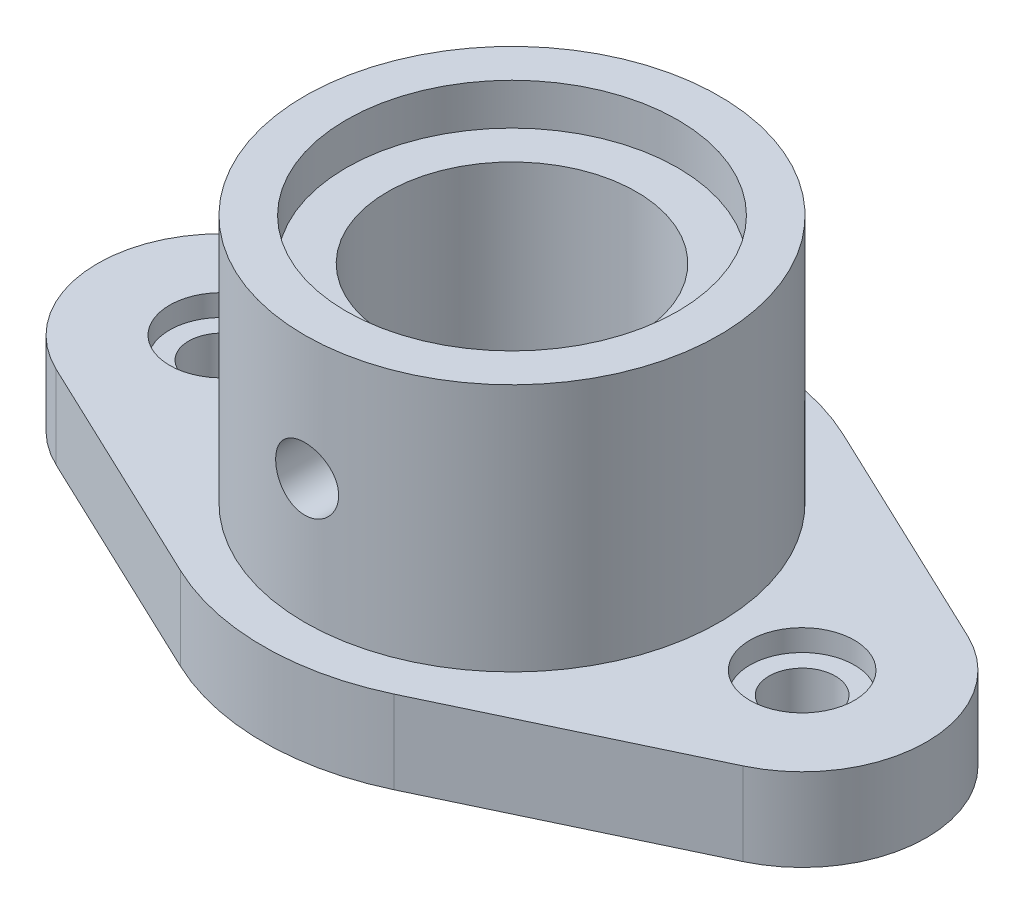
from build123d import *

# Parameters (mm, degrees)
BOSS_EXTRUDE1_DEPTH                                  = 12.7
SKETCH2_R                                            = 31.75
BOSS_EXTRUDE2_DEPTH                                  = 38.1
CBORE_FOR_3_8_BINDING_HEAD_MACHINE_SCREW_D           = 38.1
CBORE_FOR_3_8_BINDING_HEAD_MACHINE_SCREW_CBORE_D     = 50.8
CBORE_FOR_3_8_BINDING_HEAD_MACHINE_SCREW_CBORE_DEPTH = 6.35
CBORE_FOR_3_8_BINDING_HEAD_MACHINE_S_2_D             = 10.16
CBORE_FOR_3_8_BINDING_HEAD_MACHINE_S_2_CBORE_D       = 16.002
CBORE_FOR_3_8_BINDING_HEAD_MACHINE_S_2_CBORE_DEPTH   = 3.302
SKETCH9_W                                            = 4.826
SKETCH9_H                                            = 38.1


with BuildPart() as part:
    # Sketch1 → Boss-Extrude1 (new body)
    with BuildSketch(Plane(origin=(0, 0, 0), x_dir=(1, 0, 0), z_dir=(0, 1, 0))):
        with BuildLine():
            Line((-52.614285714, 17.21182555), (-16.328571429, 34.423651101))
            ThreePointArc((-16.328571429, 34.423651101), (0, 38.1), (16.328571429, 34.423651101))
            Line((16.328571429, 34.423651101), (52.614285714, 17.21182555))
            ThreePointArc((52.614285714, 17.21182555), (63.5, 0), (52.614285714, -17.21182555))
            Line((52.614285714, -17.21182555), (16.328571429, -34.423651101))
            ThreePointArc((16.328571429, -34.423651101), (0, -38.1), (-16.328571429, -34.423651101))
            Line((-16.328571429, -34.423651101), (-52.614285714, -17.21182555))
            ThreePointArc((-52.614285714, -17.21182555), (-63.5, 0), (-52.614285714, 17.21182555))
        make_face()
    extrude(amount=BOSS_EXTRUDE1_DEPTH)

    # Sketch2 → Boss-Extrude2 (add)
    with BuildSketch(Plane(origin=(0, 12.7, 0), x_dir=(1, 0, 0), z_dir=(0, 1, 0))):
        with Locations(Location((0, 0, 0), (0, 0, 90))):
            Circle(SKETCH2_R)
    extrude(amount=BOSS_EXTRUDE2_DEPTH)

    # CBORE for 3_8 Binding Head Machine Screw (through all)
    with Locations(Plane(origin=(0, 50.8, 0), x_dir=(1, 0, 0), z_dir=(0, 1, 0))):
        with Locations((0, 0)):
            CounterBoreHole(CBORE_FOR_3_8_BINDING_HEAD_MACHINE_SCREW_D / 2, CBORE_FOR_3_8_BINDING_HEAD_MACHINE_SCREW_CBORE_D / 2, CBORE_FOR_3_8_BINDING_HEAD_MACHINE_SCREW_CBORE_DEPTH)

    # CBORE for 3_8 Binding Head Machine S 2 (through all)
    with Locations(Plane(origin=(0, 12.7, 0), x_dir=(1, 0, 0), z_dir=(0, 1, 0))):
        with Locations((-44.45, 0), (44.45, 0)):
            CounterBoreHole(CBORE_FOR_3_8_BINDING_HEAD_MACHINE_S_2_D / 2, CBORE_FOR_3_8_BINDING_HEAD_MACHINE_S_2_CBORE_D / 2, CBORE_FOR_3_8_BINDING_HEAD_MACHINE_S_2_CBORE_DEPTH)

    # Sketch9 → 3/8 (0.38) Diameter Hole1 (revolve, cut)
    with BuildSketch(Plane(origin=(0, 31.75, 0), x_dir=(0, 1, 0), z_dir=(1, 0, 0))):
        with Locations((2.413, 19.05)):
            Rectangle(SKETCH9_W, SKETCH9_H)
    revolve(axis=Axis((0, 31.75, -6.35), (0, 0, 1)), mode=Mode.SUBTRACT)


solid = part.part
